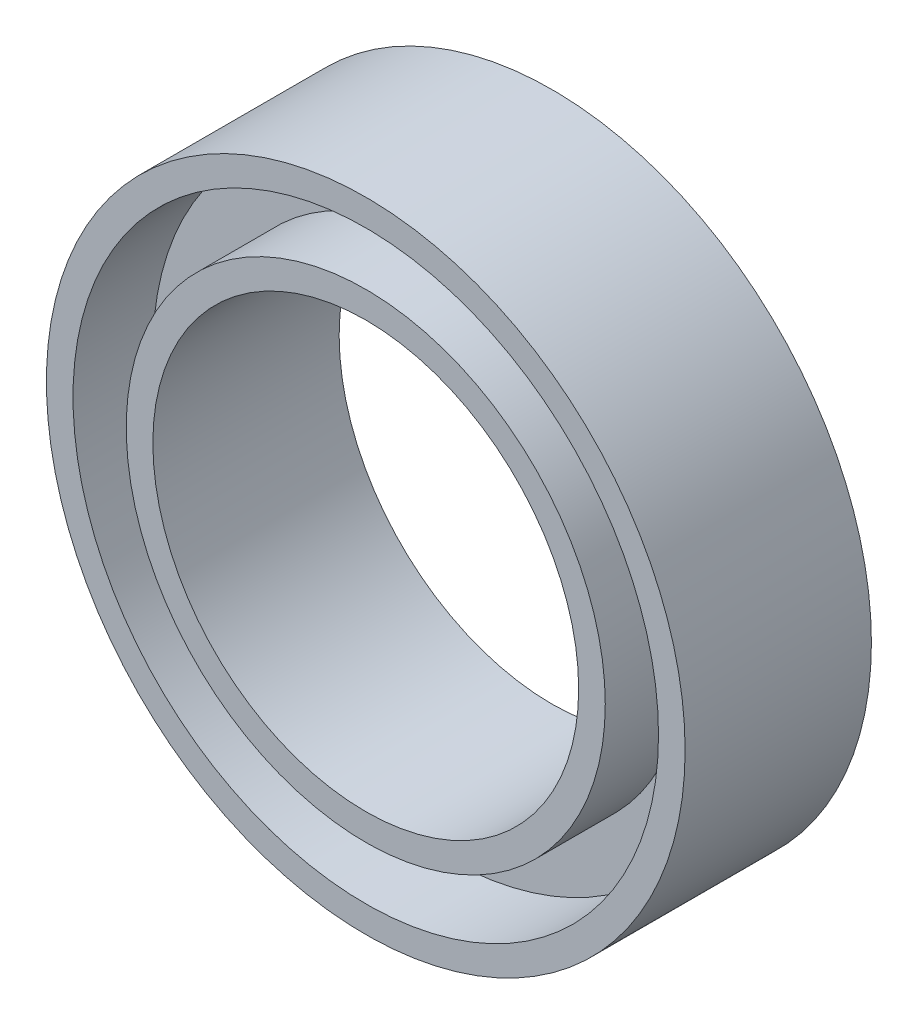
from build123d import *

# Parameters (mm, degrees)
SKETCH_1_R          = 6
SKETCH_1_R_2        = 4
EXTRUDE_1_DEPTH     = 3.5
SKETCH_2_R          = 5.5
SKETCH_2_R_2        = 4.5
CUT_EXTRUDE_1_DEPTH = 1.5
CUT_EXTRUDE_START   = -1.5
SKETCH_3_R          = 5.5
SKETCH_3_R_2        = 4.5
CUT_EXTRUDE_2_DEPTH = 1.5


with BuildPart() as part:
    # 草图1 → 凸台-拉伸1 (new body)
    with BuildSketch(Plane.XY):
        Circle(SKETCH_1_R)
        Circle(SKETCH_1_R_2, mode=Mode.SUBTRACT)
    extrude(amount=EXTRUDE_1_DEPTH)

    # 草图2 → 切除-拉伸1 (cut)
    with BuildSketch(Plane.XY.offset(3.5)):
        Circle(SKETCH_2_R)
        Circle(SKETCH_2_R_2, mode=Mode.SUBTRACT)
    extrude(amount=-CUT_EXTRUDE_1_DEPTH, mode=Mode.SUBTRACT)

    # 草图3 → 切除-拉伸2 (cut)
    with BuildSketch(Plane(origin=(0, 0, 0), x_dir=(-1, 0, 0), z_dir=(0, 0, -1)).offset(CUT_EXTRUDE_START)):
        with Locations(Location((0, 0, 0), (0, 0, 180))):
            Circle(SKETCH_3_R)
        with Locations(Location((0, 0, 0), (0, 0, 180))):
            Circle(SKETCH_3_R_2, mode=Mode.SUBTRACT)
    extrude(amount=CUT_EXTRUDE_2_DEPTH, mode=Mode.SUBTRACT)


solid = part.part
